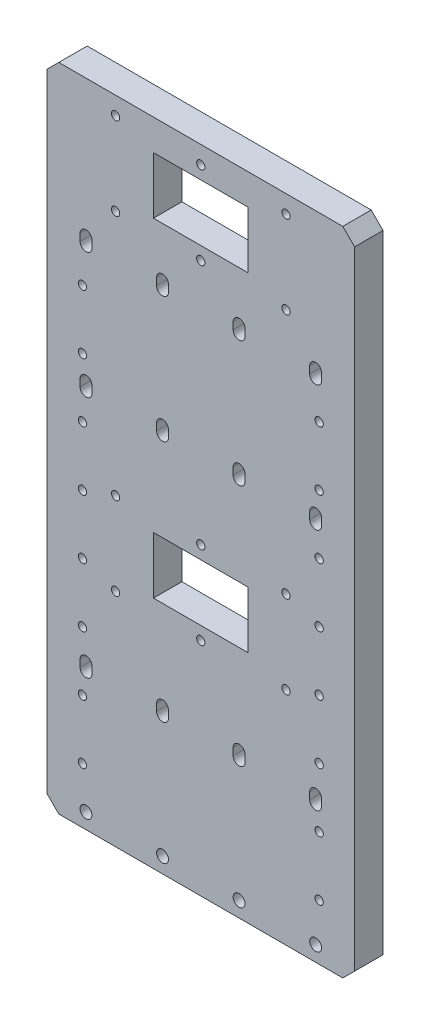
from build123d import *

# Parameters (mm, degrees)
MODEL_R             = 2.5
MODEL_R_2           = 1.75
MODEL_W             = 40
MODEL_H             = 24
BOSS_EXTRUDE1_DEPTH = 12


with BuildPart() as part:
    # Model → Boss-Extrude1 (new body)
    with BuildSketch(Plane.XY):
        Polygon((5, 275), (0, 270), (0, 5), (5, 0), (125, 0), (130, 5), (130, 270), (125, 275), align=None)
        with Locations((16.49, 6.5)):
            Circle(MODEL_R, mode=Mode.SUBTRACT)
        with Locations((48.83, 6.5)):
            Circle(MODEL_R, mode=Mode.SUBTRACT)
        with Locations((81.17, 6.5)):
            Circle(MODEL_R, mode=Mode.SUBTRACT)
        with Locations((113.51, 6.5)):
            Circle(MODEL_R, mode=Mode.SUBTRACT)
        with Locations((29, 128.5)):
            Circle(MODEL_R_2, mode=Mode.SUBTRACT)
        with Locations((65, 128.5)):
            Circle(MODEL_R_2, mode=Mode.SUBTRACT)
        with Locations((101, 128.5)):
            Circle(MODEL_R_2, mode=Mode.SUBTRACT)
        with Locations((101, 93.5)):
            Circle(MODEL_R_2, mode=Mode.SUBTRACT)
        with Locations((65, 93.5)):
            Circle(MODEL_R_2, mode=Mode.SUBTRACT)
        with Locations((29, 93.5)):
            Circle(MODEL_R_2, mode=Mode.SUBTRACT)
        with Locations((29, 267.5)):
            Circle(MODEL_R_2, mode=Mode.SUBTRACT)
        with Locations((65, 267.5)):
            Circle(MODEL_R_2, mode=Mode.SUBTRACT)
        with Locations((101, 267.5)):
            Circle(MODEL_R_2, mode=Mode.SUBTRACT)
        with Locations((101, 232.5)):
            Circle(MODEL_R_2, mode=Mode.SUBTRACT)
        with Locations((65, 232.5)):
            Circle(MODEL_R_2, mode=Mode.SUBTRACT)
        with Locations((29, 232.5)):
            Circle(MODEL_R_2, mode=Mode.SUBTRACT)
        with Locations((15, 198.5)):
            Circle(MODEL_R_2, mode=Mode.SUBTRACT)
        with Locations((15, 173.5)):
            Circle(MODEL_R_2, mode=Mode.SUBTRACT)
        with Locations((15, 148.5)):
            Circle(MODEL_R_2, mode=Mode.SUBTRACT)
        with Locations((15, 123.5)):
            Circle(MODEL_R_2, mode=Mode.SUBTRACT)
        with Locations((15, 98.5)):
            Circle(MODEL_R_2, mode=Mode.SUBTRACT)
        with Locations((15, 73.5)):
            Circle(MODEL_R_2, mode=Mode.SUBTRACT)
        with Locations((15, 48.5)):
            Circle(MODEL_R_2, mode=Mode.SUBTRACT)
        with Locations((15, 23.5)):
            Circle(MODEL_R_2, mode=Mode.SUBTRACT)
        with Locations((115, 23.5)):
            Circle(MODEL_R_2, mode=Mode.SUBTRACT)
        with Locations((115, 48.5)):
            Circle(MODEL_R_2, mode=Mode.SUBTRACT)
        with Locations((115, 73.5)):
            Circle(MODEL_R_2, mode=Mode.SUBTRACT)
        with Locations((115, 98.5)):
            Circle(MODEL_R_2, mode=Mode.SUBTRACT)
        with Locations((115, 123.5)):
            Circle(MODEL_R_2, mode=Mode.SUBTRACT)
        with Locations((115, 148.5)):
            Circle(MODEL_R_2, mode=Mode.SUBTRACT)
        with Locations((115, 173.5)):
            Circle(MODEL_R_2, mode=Mode.SUBTRACT)
        with Locations((115, 198.5)):
            Circle(MODEL_R_2, mode=Mode.SUBTRACT)
        with Locations((65, 111)):
            Rectangle(MODEL_W, MODEL_H, mode=Mode.SUBTRACT)
        with BuildLine():
            Line((13.99, 163.82), (13.99, 160.82))
            ThreePointArc((13.99, 160.82), (16.49, 158.32), (18.99, 160.82))
            Line((18.99, 160.82), (18.99, 163.82))
            ThreePointArc((18.99, 163.82), (16.49, 166.32), (13.99, 163.82))
        make_face(mode=Mode.SUBTRACT)
        with BuildLine():
            Line((46.33, 163.82), (46.33, 160.82))
            ThreePointArc((46.33, 160.82), (48.83, 158.32), (51.33, 160.82))
            Line((51.33, 160.82), (51.33, 163.82))
            ThreePointArc((51.33, 163.82), (48.83, 166.32), (46.33, 163.82))
        make_face(mode=Mode.SUBTRACT)
        with BuildLine():
            Line((78.67, 163.82), (78.67, 160.82))
            ThreePointArc((78.67, 160.82), (81.17, 158.32), (83.67, 160.82))
            Line((83.67, 160.82), (83.67, 163.82))
            ThreePointArc((83.67, 163.82), (81.17, 166.32), (78.67, 163.82))
        make_face(mode=Mode.SUBTRACT)
        with BuildLine():
            Line((111.01, 163.82), (111.01, 160.82))
            ThreePointArc((111.01, 160.82), (113.51, 158.32), (116.01, 160.82))
            Line((116.01, 160.82), (116.01, 163.82))
            ThreePointArc((116.01, 163.82), (113.51, 166.32), (111.01, 163.82))
        make_face(mode=Mode.SUBTRACT)
        with BuildLine():
            Line((13.99, 217), (13.99, 214))
            ThreePointArc((13.99, 214), (16.49, 211.5), (18.99, 214))
            Line((18.99, 214), (18.99, 217))
            ThreePointArc((18.99, 217), (16.49, 219.5), (13.99, 217))
        make_face(mode=Mode.SUBTRACT)
        with BuildLine():
            Line((51.33, 214), (51.33, 217))
            ThreePointArc((51.33, 217), (48.83, 219.5), (46.33, 217))
            Line((46.33, 217), (46.33, 214))
            ThreePointArc((46.33, 214), (48.83, 211.5), (51.33, 214))
        make_face(mode=Mode.SUBTRACT)
        with BuildLine():
            Line((83.67, 214), (83.67, 217))
            ThreePointArc((83.67, 217), (81.17, 219.5), (78.67, 217))
            Line((78.67, 217), (78.67, 214))
            ThreePointArc((78.67, 214), (81.17, 211.5), (83.67, 214))
        make_face(mode=Mode.SUBTRACT)
        with BuildLine():
            Line((116.01, 214), (116.01, 217))
            ThreePointArc((116.01, 217), (113.51, 219.5), (111.01, 217))
            Line((111.01, 217), (111.01, 214))
            ThreePointArc((111.01, 214), (113.51, 211.5), (116.01, 214))
        make_face(mode=Mode.SUBTRACT)
        with BuildLine():
            Line((18.99, 58.18), (18.99, 61.18))
            ThreePointArc((18.99, 61.18), (16.49, 63.68), (13.99, 61.18))
            Line((13.99, 61.18), (13.99, 58.18))
            ThreePointArc((13.99, 58.18), (16.49, 55.68), (18.99, 58.18))
        make_face(mode=Mode.SUBTRACT)
        with BuildLine():
            Line((51.33, 58.18), (51.33, 61.18))
            ThreePointArc((51.33, 61.18), (48.83, 63.68), (46.33, 61.18))
            Line((46.33, 61.18), (46.33, 58.18))
            ThreePointArc((46.33, 58.18), (48.83, 55.68), (51.33, 58.18))
        make_face(mode=Mode.SUBTRACT)
        with BuildLine():
            Line((83.67, 58.18), (83.67, 61.18))
            ThreePointArc((83.67, 61.18), (81.17, 63.68), (78.67, 61.18))
            Line((78.67, 61.18), (78.67, 58.18))
            ThreePointArc((78.67, 58.18), (81.17, 55.68), (83.67, 58.18))
        make_face(mode=Mode.SUBTRACT)
        with BuildLine():
            Line((116.01, 58.18), (116.01, 61.18))
            ThreePointArc((116.01, 61.18), (113.51, 63.68), (111.01, 61.18))
            Line((111.01, 61.18), (111.01, 58.18))
            ThreePointArc((111.01, 58.18), (113.51, 55.68), (116.01, 58.18))
        make_face(mode=Mode.SUBTRACT)
        with Locations((65, 250)):
            Rectangle(MODEL_W, MODEL_H, mode=Mode.SUBTRACT)
    extrude(amount=BOSS_EXTRUDE1_DEPTH)


solid = part.part
